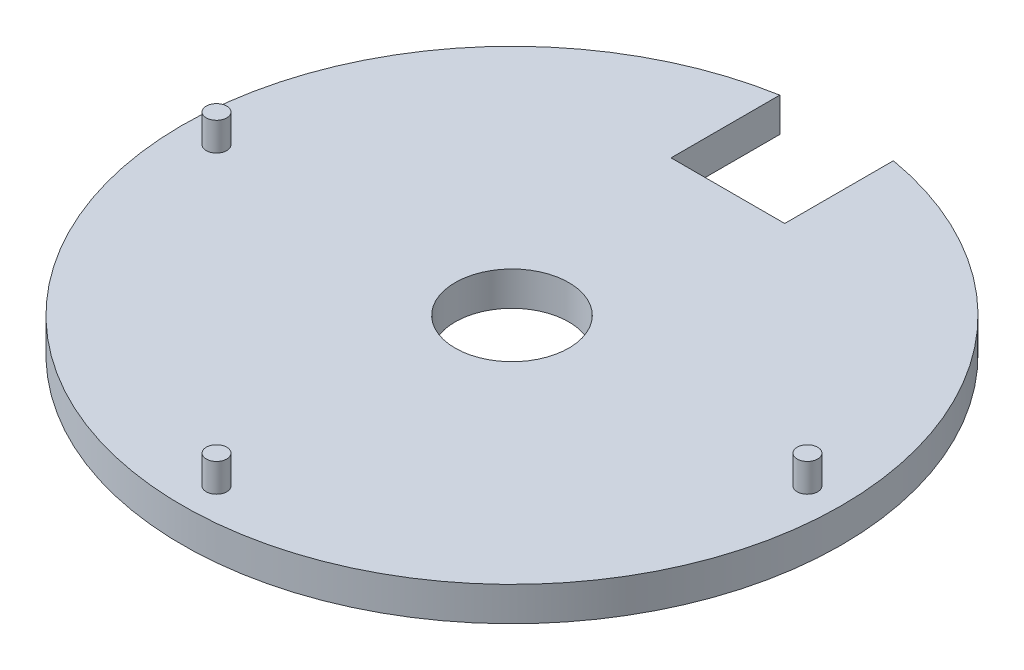
from build123d import *

# Parameters (mm, degrees)
SKETCH1_R           = 29
BOSS_EXTRUDE1_DEPTH = 3
SKETCH6_R           = 0.9
BOSS_EXTRUDE3_DEPTH = 2.5
SKETCH7_R           = 0.9
BOSS_EXTRUDE4_DEPTH = 2.5
SKETCH8_R           = 5
CUT_EXTRUDE2_DEPTH  = 3
CUT_EXTRUDE3_DEPTH  = 10


with BuildPart() as part:
    # Sketch1 → Boss-Extrude1 (new body)
    with BuildSketch(Plane(origin=(0, 0, 0), x_dir=(1, 0, 0), z_dir=(0, 1, 0))):
        with Locations(Location((0, 0, 0), (0, 0, 270))):
            Circle(SKETCH1_R)
    extrude(amount=BOSS_EXTRUDE1_DEPTH)

    # Sketch6 → Boss-Extrude3 (add)
    with BuildSketch(Plane(origin=(0, 3, 0), x_dir=(1, 0, 0), z_dir=(0, 1, 0))):
        with Locations(Location((-26, 0, 0), (0, 0, 270))):
            Circle(SKETCH6_R)
        with Locations(Location((26, 0, 0), (0, 0, 270))):
            Circle(SKETCH6_R)
    extrude(amount=BOSS_EXTRUDE3_DEPTH)

    # Sketch7 → Boss-Extrude4 (add)
    with BuildSketch(Plane(origin=(0, 3, 0), x_dir=(1, 0, 0), z_dir=(0, 1, 0))):
        with Locations(Location((0, -26, 0), (0, 0, 270))):
            Circle(SKETCH7_R)
    extrude(amount=BOSS_EXTRUDE4_DEPTH)

    # Sketch8 → Cut-Extrude2 (cut)
    with BuildSketch(Plane(origin=(0, 3, 0), x_dir=(1, 0, 0), z_dir=(0, 1, 0))):
        with Locations(Location((0, 0, 0), (0, 0, 270))):
            Circle(SKETCH8_R)
    extrude(amount=-CUT_EXTRUDE2_DEPTH, mode=Mode.SUBTRACT)

    # Sketch9 → Cut-Extrude3 (cut)
    with BuildSketch(Plane(origin=(0, 3, 0), x_dir=(1, 0, 0), z_dir=(0, 1, 0))):
        Polygon((0, 29), (5, 29), (5, 19), (-5, 19), (-5, 29), align=None)
    extrude(amount=-CUT_EXTRUDE3_DEPTH, mode=Mode.SUBTRACT)


solid = part.part
